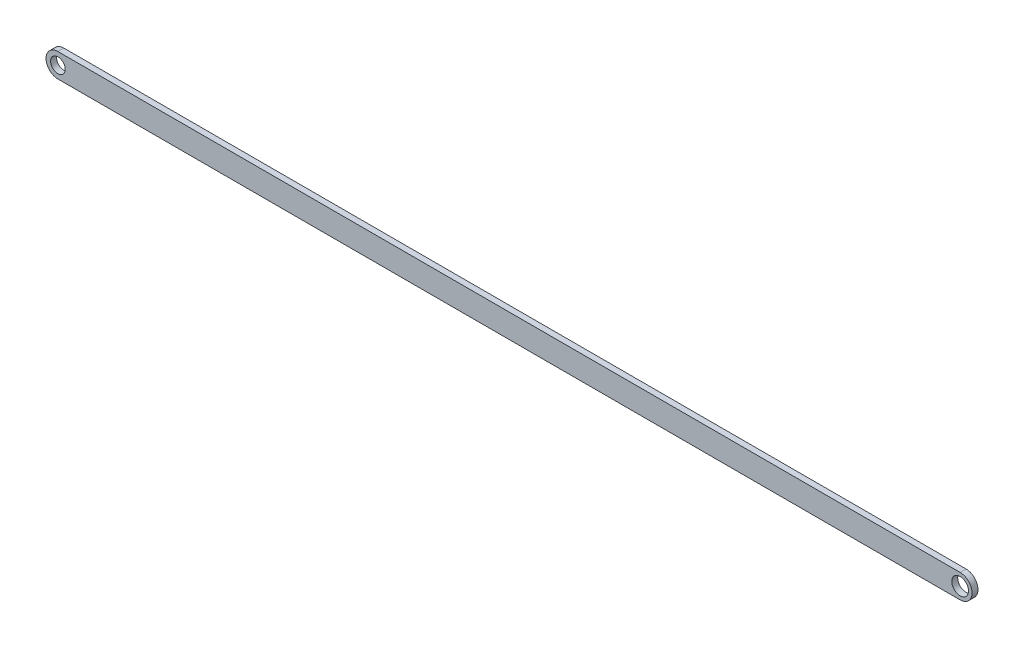
from build123d import *

# Parameters (mm, degrees)
SKETCH_1_R      = 7.032299157
SKETCH_1_R_2    = 6.144266803
EXTRUDE_1_DEPTH = 5


with BuildPart() as part:
    # 草图1 → 凸台-拉伸1 (new body)
    with BuildSketch(Plane.XY):
        with BuildLine():
            Line((-378.7, 10), (378.7, 10))
            ThreePointArc((378.7, 10), (388.7, 0), (378.7, -10))
            Line((378.7, -10), (-378.7, -10))
            ThreePointArc((-378.7, -10), (-388.7, 0), (-378.7, 10))
        make_face()
        with Locations((378.7, 0)):
            Circle(SKETCH_1_R, mode=Mode.SUBTRACT)
        with Locations((-378.7, 0)):
            Circle(SKETCH_1_R_2, mode=Mode.SUBTRACT)
    extrude(amount=EXTRUDE_1_DEPTH)


solid = part.part
